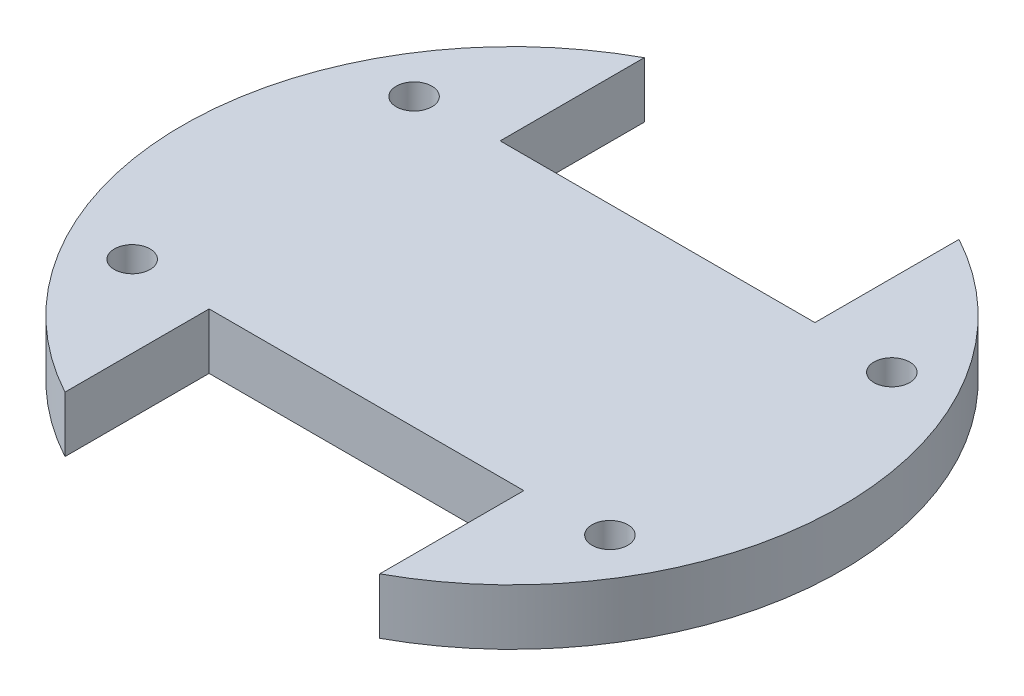
from build123d import *

# Parameters (mm, degrees)
SKETCH_1_R          = 29.5
EXTRUDE_1_DEPTH     = 5
SKETCH_2_W          = 28.166253132
SKETCH_2_H          = 32.95394871
CUT_EXTRUDE_1_DEPTH = 43.017853348
SKETCH_6_R          = 1.6
CUT_EXTRUDE_5_DEPTH = 40.587441773


with BuildPart() as part:
    # 草图1 → 凸台-拉伸1 (new body)
    with BuildSketch(Plane(origin=(0, 0, 0), x_dir=(1, 0, 0), z_dir=(0, 1, 0))):
        with Locations(Location((0, 0, 0), (0, 0, 270))):
            Circle(SKETCH_1_R)
    extrude(amount=EXTRUDE_1_DEPTH)

    # 草图2 → 切除-拉伸1 (cut, through all)
    with BuildSketch(Plane(origin=(0, 5, 0), x_dir=(1, 0, 0), z_dir=(0, 1, 0))):
        with Locations((0, 29.5)):
            Rectangle(SKETCH_2_W, SKETCH_2_H)
        with Locations((0, -29.5)):
            Rectangle(SKETCH_2_W, SKETCH_2_H)
    extrude(amount=-CUT_EXTRUDE_1_DEPTH, mode=Mode.SUBTRACT)

    # 草图6 → 切除-拉伸5 (cut, through all)
    with BuildSketch(Plane(origin=(0, 5, 0), x_dir=(1, 0, 0), z_dir=(0, 1, 0))):
        with Locations(Location((-21.376, 12.613, 0), (0, 0, 270))):
            Circle(SKETCH_6_R)
        with Locations(Location((-21.376, -12.613, 0), (0, 0, 270))):
            Circle(SKETCH_6_R)
        with Locations(Location((21.376, 12.613, 0), (0, 0, 270))):
            Circle(SKETCH_6_R)
        with Locations(Location((21.376, -12.613, 0), (0, 0, 270))):
            Circle(SKETCH_6_R)
    extrude(amount=-CUT_EXTRUDE_5_DEPTH, mode=Mode.SUBTRACT)


solid = part.part
